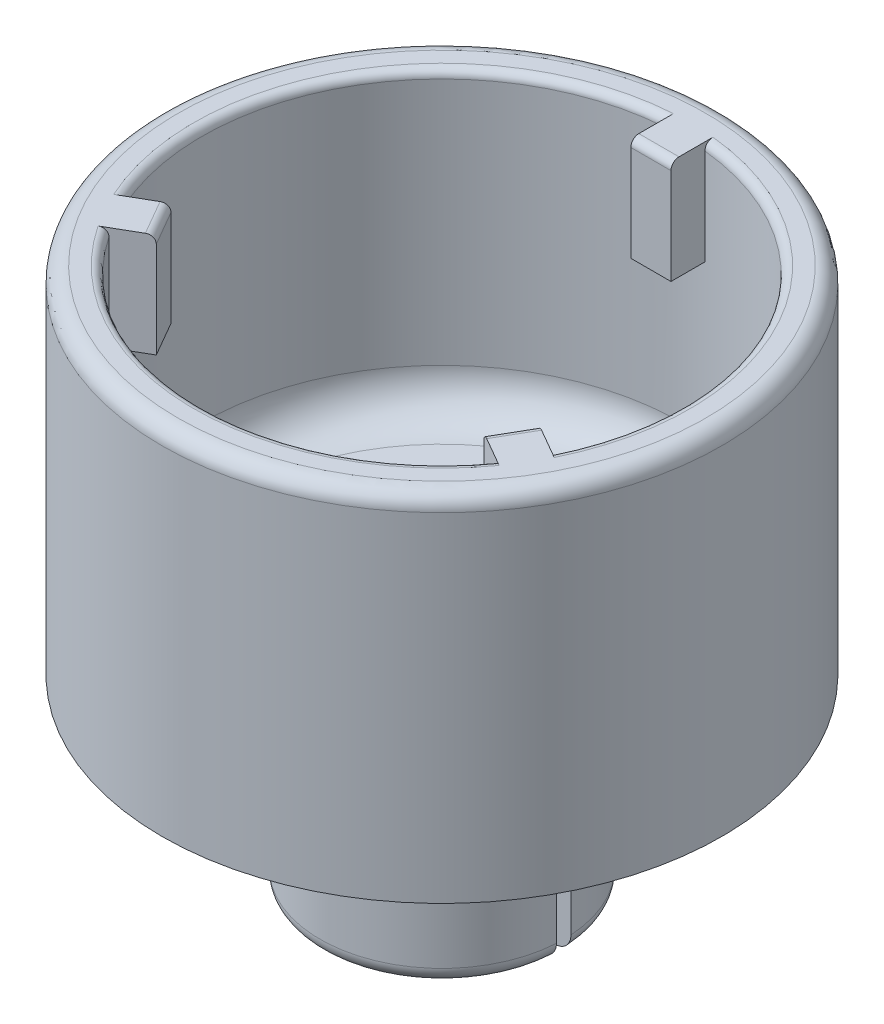
from build123d import *

# Parameters (mm, degrees)
SKETCH1_R           = 35
BOSS_EXTRUDE1_DEPTH = 44.3
SKETCH2_R           = 30
CUT_EXTRUDE1_DEPTH  = 37
SKETCH3_R           = 19.5
BOSS_EXTRUDE2_DEPTH = 7
SKETCH4_R           = 15.25
BOSS_EXTRUDE3_DEPTH = 16
FILLET1_R           = 5
BOSS_EXTRUDE4_DEPTH = 13
SKETCH7_W           = 66.193685288
SKETCH7_H           = 1.806726502
CUT_EXTRUDE2_DEPTH  = 16
FILLET2_R           = 2
FILLET3_R           = 5
FILLET4_R           = 2
FILLET5_R           = 1
FILLET6_R           = 1


with BuildPart() as part:
    # Sketch1 → Boss-Extrude1 (new body)
    with BuildSketch(Plane(origin=(0, 0, 0), x_dir=(1, 0, 0), z_dir=(0, 1, 0))):
        with Locations(Location((0, 0, 0), (0, 0, 270))):
            Circle(SKETCH1_R)
    extrude(amount=BOSS_EXTRUDE1_DEPTH)

    # Sketch2 → Cut-Extrude1 (cut)
    with BuildSketch(Plane(origin=(0, 44.3, 0), x_dir=(1, 0, 0), z_dir=(0, 1, 0))):
        with Locations(Location((0, 0, 0), (0, 0, 270))):
            Circle(SKETCH2_R)
    extrude(amount=-CUT_EXTRUDE1_DEPTH, mode=Mode.SUBTRACT)

    # Sketch3 → Boss-Extrude2 (add)
    with BuildSketch(Plane.XZ):
        with Locations(Location((0, 0, 0), (0, 0, 270))):
            Circle(SKETCH3_R)
    extrude(amount=BOSS_EXTRUDE2_DEPTH)

    # Sketch4 → Boss-Extrude3 (add)
    with BuildSketch(Plane.XZ.offset(7)):
        with Locations(Location((0, 0, 0), (0, 0, 270))):
            Circle(SKETCH4_R)
    extrude(amount=BOSS_EXTRUDE3_DEPTH)

    # Fillet1
    fillet1_edges = [part.edges().sort_by_distance(p)[0] for p in [
        (0, 0, 19.5),
    ]]
    fillet(fillet1_edges, radius=FILLET1_R)

    # Sketch5 → Boss-Extrude4 (add)
    with BuildSketch(Plane(origin=(0, 44.3, 0), x_dir=(1, 0, 0), z_dir=(0, 1, 0))):
        with BuildLine():
            Line((-1.990534123, 29.933890056), (-1.990534123, 25.605317076))
            Line((-1.990534123, 25.605317076), (3.030233114, 25.605317076))
            Line((3.030233114, 25.605317076), (3.030233114, 29.846569104))
            ThreePointArc((3.030233114, 29.846569104), (0.521679725, 29.995463828), (-1.990534123, 29.933890056))
        make_face()
        with BuildLine():
            Line((26.918776284, -13.243091911), (23.170122121, -11.07880542))
            Line((23.170122121, -11.07880542), (20.659738503, -15.426917394))
            Line((20.659738503, -15.426917394), (24.332770503, -17.547543408))
            ThreePointArc((24.332770503, -17.547543408), (25.715993811, -15.449519808), (26.918776284, -13.243091911))
        make_face()
        with BuildLine():
            Line((-24.928242161, -16.690798146), (-21.179587998, -14.526511655))
            Line((-21.179587998, -14.526511655), (-23.689971616, -10.178399682))
            Line((-23.689971616, -10.178399682), (-27.363003617, -12.299025696))
            ThreePointArc((-27.363003617, -12.299025696), (-26.237673536, -14.54594402), (-24.928242161, -16.690798146))
        make_face()
    extrude(amount=-BOSS_EXTRUDE4_DEPTH)

    # Sketch7 → Cut-Extrude2 (cut)
    with BuildSketch(Plane.XZ.offset(23)):
        Rectangle(SKETCH7_W, SKETCH7_H)
    extrude(amount=-CUT_EXTRUDE2_DEPTH, mode=Mode.SUBTRACT)

    # Fillet2
    fillet2_edges = [part.edges().sort_by_distance(p)[0] for p in [
        (0, -23, 15.25),
        (0, -23, -15.25),
    ]]
    fillet(fillet2_edges, radius=FILLET2_R)

    # Fillet3
    fillet3_edges = [part.edges().sort_by_distance(p)[0] for p in [
        (0, 7.3, -30),
    ]]
    fillet(fillet3_edges, radius=FILLET3_R)

    # Fillet4
    fillet4_edges = [part.edges().sort_by_distance(p)[0] for p in [
        (0, 44.3, -35),
    ]]
    fillet(fillet4_edges, radius=FILLET4_R)

    # Fillet5
    fillet5_edges = [part.edges().sort_by_distance(p)[0] for p in [
        (-25.715993811, 44.3, -15.449519808),
        (26.237673536, 44.3, -14.54594402),
        (-14.129332179, 44.3, 26.464352858),
    ]]
    fillet(fillet5_edges, radius=FILLET5_R)

    # Fillet6
    fillet6_edges = [part.edges().sort_by_distance(p)[0] for p in [
        (0.519849495, 44.3, -25.605317076),
        (21.914930312, 44.3, 13.252861407),
        (-22.434779807, 44.3, 12.352455669),
    ]]
    fillet(fillet6_edges, radius=FILLET6_R)


solid = part.part
